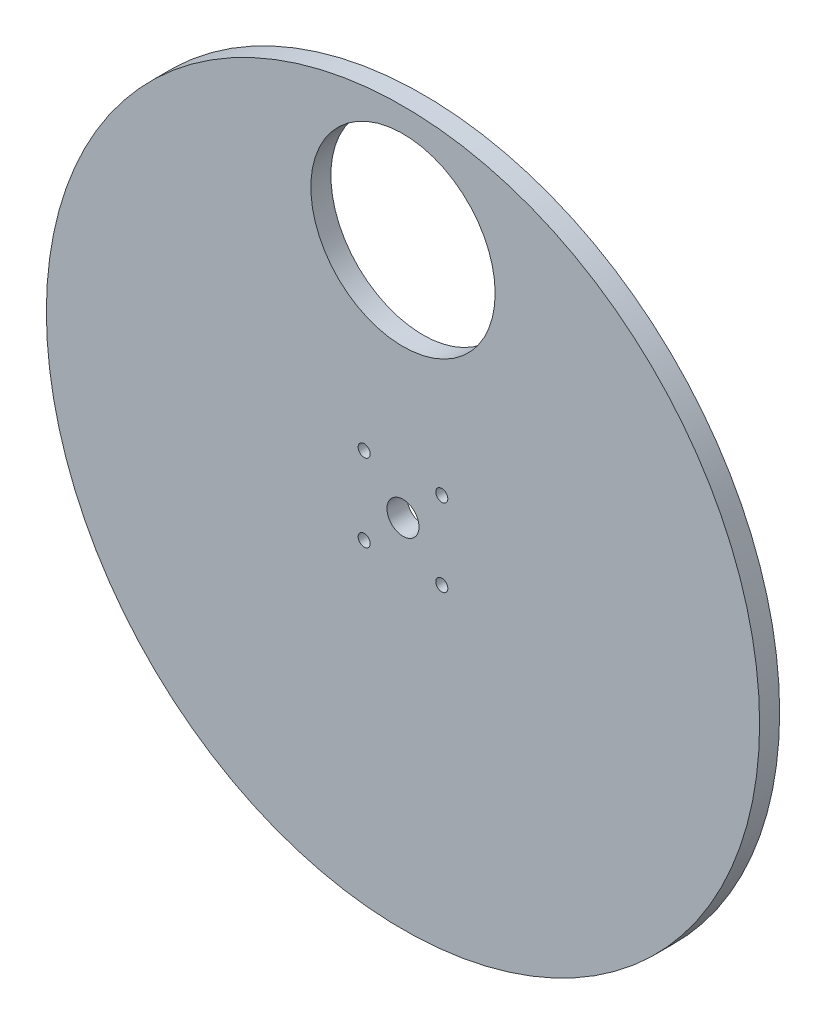
from build123d import *

# Parameters (mm, degrees)
SKETCH1_R           = 89
SKETCH1_R_2         = 4
SKETCH1_R_3         = 1.5
SKETCH1_R_4         = 23
BOSS_EXTRUDE1_DEPTH = 5


with BuildPart() as part:
    # Sketch1 → Boss-Extrude1 (new body)
    with BuildSketch(Plane.XY):
        Circle(SKETCH1_R)
        Circle(SKETCH1_R_2, mode=Mode.SUBTRACT)
        with Locations((-9.686203462, 9.686203462)):
            Circle(SKETCH1_R_3, mode=Mode.SUBTRACT)
        with Locations((0, 60)):
            Circle(SKETCH1_R_4, mode=Mode.SUBTRACT)
        with Locations((9.686203462, 9.686203462)):
            Circle(SKETCH1_R_3, mode=Mode.SUBTRACT)
        with Locations((9.686203462, -9.686203462)):
            Circle(SKETCH1_R_3, mode=Mode.SUBTRACT)
        with Locations((-9.686203462, -9.686203462)):
            Circle(SKETCH1_R_3, mode=Mode.SUBTRACT)
    extrude(amount=BOSS_EXTRUDE1_DEPTH)


solid = part.part
